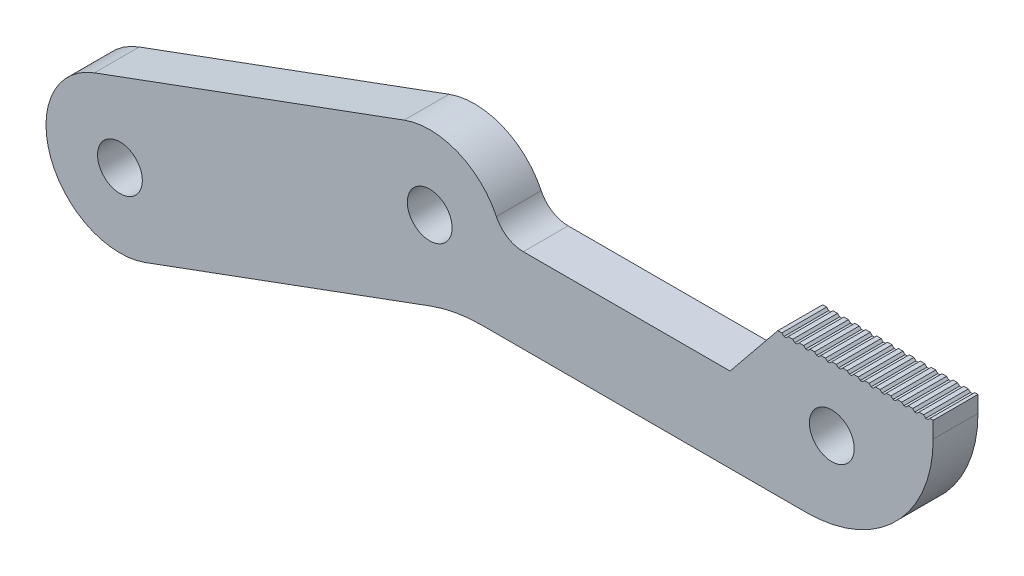
from build123d import *

# Parameters (mm, degrees)
SKETCH2_R           = 1.5
BOSS_EXTRUDE1_DEPTH = 3


with BuildPart() as part:
    # Sketch2 → Boss-Extrude1 (new body)
    with BuildSketch(Plane.XY):
        with BuildLine():
            Line((2.936670729, 6.354601878), (23.677794427, 13.984528989))
            ThreePointArc((23.677794427, 13.984528989), (27.248698254, 13.925360384), (29.850364144, 11.47869129))
            ThreePointArc((29.850364144, 11.47869129), (30.588272685, 10.65075377), (31.653840565, 10.343256382))
            Line((31.653840565, 10.343256382), (45.495725577, 10.343256382))
            Line((45.495725577, 10.343256382), (48.695725577, 14.288892686))
            Line((48.695725577, 14.288892686), (48.964283059, 14.288892686))
            Line((48.964283059, 14.288892686), (49.101750655, 14.15142509))
            Line((49.101750655, 14.15142509), (49.250184878, 14.15142509))
            Line((49.250184878, 14.15142509), (49.387652474, 14.288892686))
            Line((49.387652474, 14.288892686), (49.694283059, 14.288892686))
            Line((49.694283059, 14.288892686), (49.831750655, 14.15142509))
            Line((49.831750655, 14.15142509), (49.980184878, 14.15142509))
            Line((49.980184878, 14.15142509), (50.117652474, 14.288892686))
            Line((50.117652474, 14.288892686), (50.424283059, 14.288892686))
            Line((50.424283059, 14.288892686), (50.561750655, 14.15142509))
            Line((50.561750655, 14.15142509), (50.710184878, 14.15142509))
            Line((50.710184878, 14.15142509), (50.847652474, 14.288892686))
            Line((50.847652474, 14.288892686), (51.154283059, 14.288892686))
            Line((51.154283059, 14.288892686), (51.291750655, 14.15142509))
            Line((51.291750655, 14.15142509), (51.440184878, 14.15142509))
            Line((51.440184878, 14.15142509), (51.577652474, 14.288892686))
            Line((51.577652474, 14.288892686), (51.884283059, 14.288892686))
            Line((51.884283059, 14.288892686), (52.021750655, 14.15142509))
            Line((52.021750655, 14.15142509), (52.170184878, 14.15142509))
            Line((52.170184878, 14.15142509), (52.307652474, 14.288892686))
            Line((52.307652474, 14.288892686), (52.614283059, 14.288892686))
            Line((52.614283059, 14.288892686), (52.751750655, 14.15142509))
            Line((52.751750655, 14.15142509), (52.900184878, 14.15142509))
            Line((52.900184878, 14.15142509), (53.037652474, 14.288892686))
            Line((53.037652474, 14.288892686), (53.344283059, 14.288892686))
            Line((53.344283059, 14.288892686), (53.481750655, 14.15142509))
            Line((53.481750655, 14.15142509), (53.630184878, 14.15142509))
            Line((53.630184878, 14.15142509), (53.767652474, 14.288892686))
            Line((53.767652474, 14.288892686), (54.074283059, 14.288892686))
            Line((54.074283059, 14.288892686), (54.211750655, 14.15142509))
            Line((54.211750655, 14.15142509), (54.360184878, 14.15142509))
            Line((54.360184878, 14.15142509), (54.497652474, 14.288892686))
            Line((54.497652474, 14.288892686), (54.804283059, 14.288892686))
            Line((54.804283059, 14.288892686), (54.941750655, 14.15142509))
            Line((54.941750655, 14.15142509), (55.090184878, 14.15142509))
            Line((55.090184878, 14.15142509), (55.227652474, 14.288892686))
            Line((55.227652474, 14.288892686), (55.534283059, 14.288892686))
            Line((55.534283059, 14.288892686), (55.671750655, 14.15142509))
            Line((55.671750655, 14.15142509), (55.820184878, 14.15142509))
            Line((55.820184878, 14.15142509), (55.957652474, 14.288892686))
            Line((55.957652474, 14.288892686), (56.264283059, 14.288892686))
            Line((56.264283059, 14.288892686), (56.401750655, 14.15142509))
            Line((56.401750655, 14.15142509), (56.550184878, 14.15142509))
            Line((56.550184878, 14.15142509), (56.687652474, 14.288892686))
            Line((56.687652474, 14.288892686), (56.994283059, 14.288892686))
            Line((56.994283059, 14.288892686), (57.131750655, 14.15142509))
            Line((57.131750655, 14.15142509), (57.280184878, 14.15142509))
            Line((57.280184878, 14.15142509), (57.417652474, 14.288892686))
            Line((57.417652474, 14.288892686), (57.724283059, 14.288892686))
            Line((57.724283059, 14.288892686), (57.861750655, 14.15142509))
            Line((57.861750655, 14.15142509), (58.010184878, 14.15142509))
            Line((58.010184878, 14.15142509), (58.147652474, 14.288892686))
            Line((58.147652474, 14.288892686), (58.454283059, 14.288892686))
            Line((58.454283059, 14.288892686), (58.591750655, 14.15142509))
            Line((58.591750655, 14.15142509), (58.740184878, 14.15142509))
            Line((58.740184878, 14.15142509), (58.877652474, 14.288892686))
            Line((58.877652474, 14.288892686), (59.095725577, 14.288892686))
            Line((59.095725577, 14.288892686), (59.095725577, 13.193256382))
            ThreePointArc((59.095725577, 13.193256382), (56.606133217, 7.182848742), (50.595725577, 4.693256382))
            Line((50.595725577, 4.693256382), (28.876707599, 4.693256382))
            ThreePointArc((28.876707599, 4.693256382), (27.123316378, 4.538337348), (25.424251892, 4.078380228))
            Line((25.424251892, 4.078380228), (6.354601878, -2.936670729))
            ThreePointArc((6.354601878, -2.936670729), (0, 0), (2.936670729, 6.354601878))
        make_face()
        with Locations((4.645636304, 1.708965575)):
            Circle(SKETCH2_R, mode=Mode.SUBTRACT)
        with Locations((25.386760002, 9.338892686)):
            Circle(SKETCH2_R, mode=Mode.SUBTRACT)
        with Locations((52.307652474, 9.994763619)):
            Circle(SKETCH2_R, mode=Mode.SUBTRACT)
    extrude(amount=BOSS_EXTRUDE1_DEPTH)


solid = part.part
